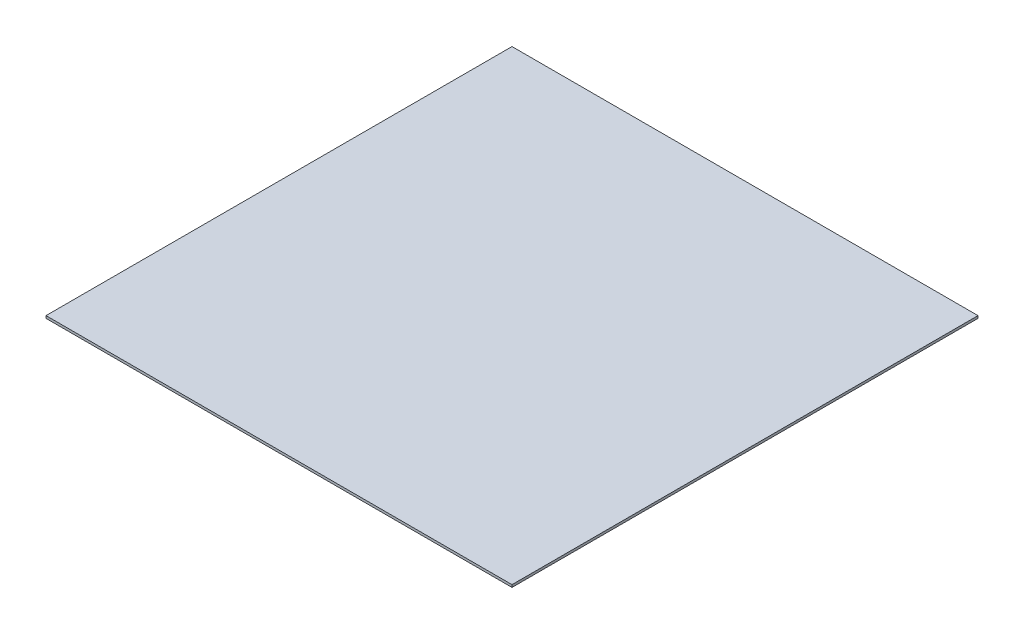
from build123d import *

# Parameters (mm, degrees)
SKETCH1_W           = 609.6
SKETCH1_H           = 609.6
BOSS_EXTRUDE1_DEPTH = 3.175


with BuildPart() as part:
    # Sketch1 → Boss-Extrude1 (new body)
    with BuildSketch(Plane(origin=(0, 0, 0), x_dir=(1, 0, 0), z_dir=(0, 1, 0))):
        Rectangle(SKETCH1_W, SKETCH1_H)
    extrude(amount=BOSS_EXTRUDE1_DEPTH)


solid = part.part
